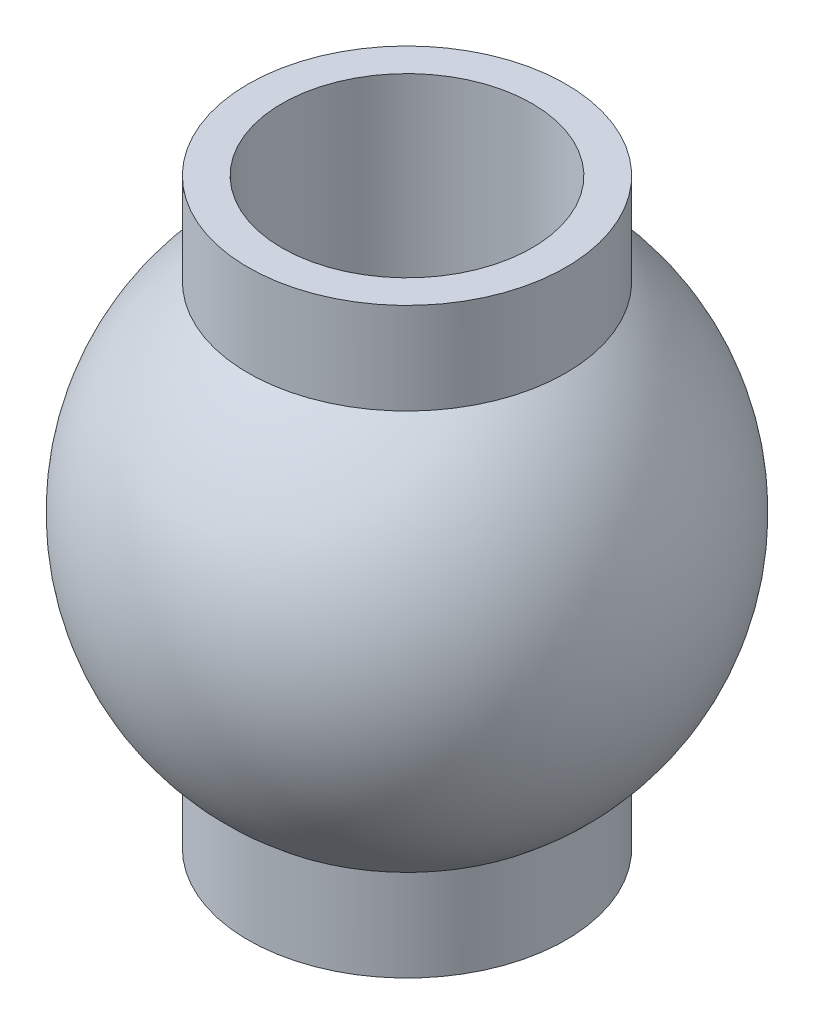
from build123d import *
from build123d.topology import SkipClean

# Parameters (mm, degrees)
CUT_EXTRUDE1_DEPTH      = 6.56177356874586
CUT_EXTRUDE1_DEPTH_BACK = 6.56177356874586
SKETCH2_R               = 1.5


with BuildPart() as part:
    # Sketch1 → Revolve1 (revolve)
    with SkipClean():  # the faces are left unmerged after this step: merging them gives an invalid solid
        with BuildSketch(Plane.XY, mode=Mode.PRIVATE) as revolve1_sk:
            with BuildLine():
                Line((1.904999999999999, 2.3955916784794526), (-4.4e-16, 2.3955916784794526))
                Line((-3.7e-16, 2.3955916784794526), (-7e-17, -2.395591678479453))
                Line((0, -2.395591678479453), (1.9049999999999987, -2.395591678479453))
                ThreePointArc((1.9049999999999983, -2.3955916784794535), (2.756675351759796, -1.329896798627624), (3.0606999999999998, -7.5e-16))
                ThreePointArc((3.0606999999999998, 0), (2.7566753517597964, 1.3298967986276231), (1.9049999999999991, 2.3955916784794526))
            make_face()
            with BuildLine():
                Line((-7e-17, -2.395591678479453), (-3.7e-16, 2.3955916784794526))
                Line((-4.4e-16, 2.3955916784794526), (-1.904999999999999, 2.3955916784794526))
                ThreePointArc((-1.9049999999999985, 2.395591678479453), (-3.0606999999999998, 3.7e-16), (-1.9049999999999991, -2.3955916784794526))
                Line((-1.905000000000001, -2.3955916784794535), (0, -2.395591678479453))
            make_face()
            with BuildLine():
                ThreePointArc((1.904999999999999, 2.395591678479453), (1.0088847901712508, 2.88964287934705), (-8.34e-14, 3.0606999999999998))
                Line((-4.1e-16, 3.0606999999999998), (-3.7e-16, 2.3955916784794526))
                Line((-4.4e-16, 2.3955916784794526), (1.904999999999999, 2.3955916784794526))
            make_face()
            with BuildLine():
                Line((-3.7e-16, 2.3955916784794526), (-4.1e-16, 3.0606999999999998))
                ThreePointArc((-8.34e-14, 3.0606999999999998), (-1.0088847901713298, 2.889642879347022), (-1.9049999999999985, 2.395591678479453))
                Line((-1.904999999999999, 2.3955916784794526), (-4.4e-16, 2.3955916784794526))
            make_face()
            with BuildLine():
                Line((1.9049999999999998, 3.4925), (-4.4e-16, 3.4925))
                Line((-4.3e-16, 3.4925), (-4.1e-16, 3.0606999999999998))
                ThreePointArc((-8.34e-14, 3.0606999999999998), (1.0088847901712508, 2.88964287934705), (1.904999999999999, 2.395591678479453))
                Line((1.904999999999999, 2.3955916784794526), (1.9049999999999998, 3.4925))
            make_face()
            with BuildLine():
                Line((1.9049999999999987, -2.395591678479453), (0, -2.395591678479453))
                Line((-7e-17, -2.395591678479453), (-3e-17, -3.0607))
                ThreePointArc((8.099e-14, -3.0606999999999998), (1.0088847901713283, -2.889642879347023), (1.9049999999999983, -2.3955916784794535))
            make_face()
            with BuildLine():
                Line((-3e-17, -3.0607), (-7e-17, -2.395591678479453))
                Line((0, -2.395591678479453), (-1.905000000000001, -2.3955916784794535))
                ThreePointArc((-1.9049999999999991, -2.3955916784794526), (-1.0088847901712523, -2.8896428793470497), (8.099e-14, -3.0606999999999998))
            make_face()
            with BuildLine():
                ThreePointArc((1.9049999999999983, -2.3955916784794535), (1.0088847901713283, -2.889642879347023), (8.099e-14, -3.0606999999999998))
                Line((-3e-17, -3.0607), (0, -3.4925))
                Line((0, -3.4925), (1.905, -3.4925))
                Line((1.9049999999999998, -3.4925), (1.904999999999999, -2.395591678479453))
            make_face()
        revolve(revolve1_sk.sketch.rotate(Axis((-4.3e-16, 3.4925, 0), (6e-17, -1, 0)), 180), axis=Axis((-4.3e-16, 3.4925, 0), (6e-17, -1, 0)))

    # Sketch2 → Cut-Extrude1 (cut, two sides: drawn at the far end of the back side and taken through both)
    with BuildSketch(Plane(origin=(0, 0, 0), x_dir=(1, 0, 0), z_dir=(0, 1, 0)).offset(-CUT_EXTRUDE1_DEPTH_BACK)):
        with Locations(Location((-4.3e-16, 0, 0), (0, 0, 270))):
            Circle(SKETCH2_R)
    extrude(amount=CUT_EXTRUDE1_DEPTH + CUT_EXTRUDE1_DEPTH_BACK, mode=Mode.SUBTRACT)


solid = part.part
